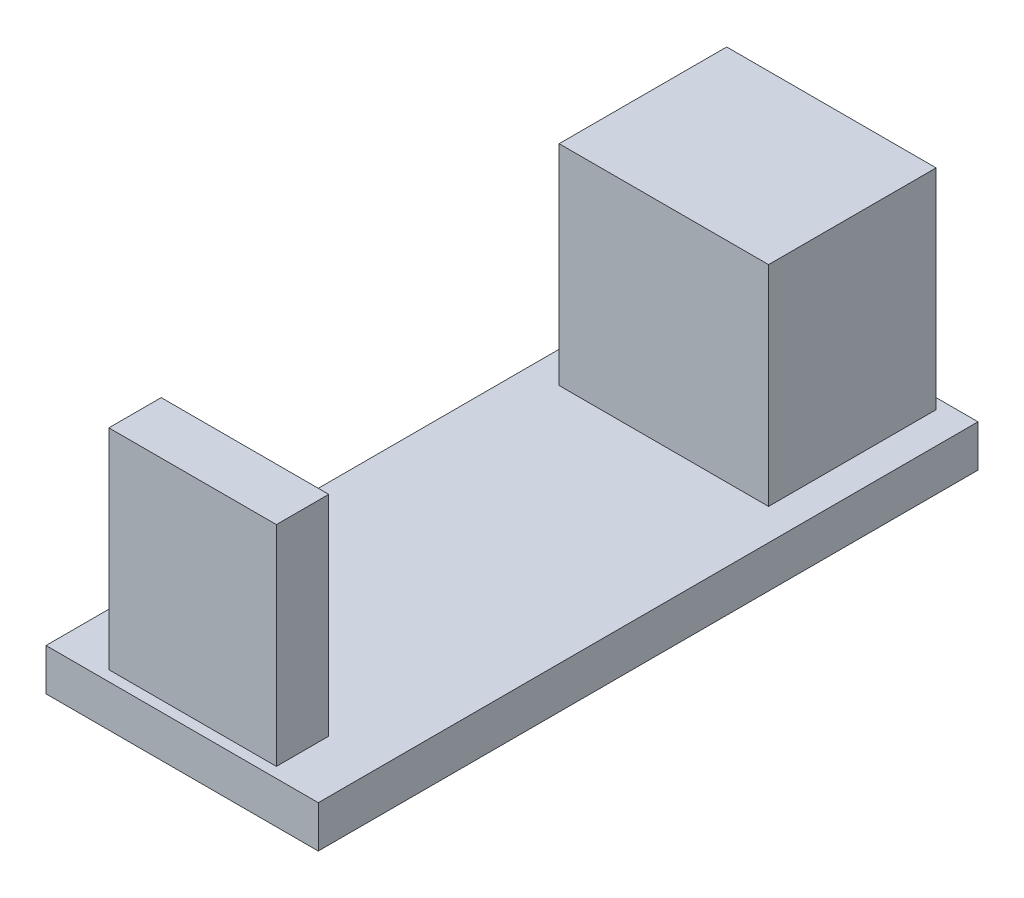
from build123d import *

# Parameters (mm, degrees)
ESBO_O1_W                = 13
ESBO_O1_H                = 31.5
RESSALTO_EXTRUS_O1_DEPTH = 2
ESBO_O2_W                = 10
ESBO_O2_H                = 8
ESBO_O2_W_2              = 8
ESBO_O2_H_2              = 2.5
RESSALTO_EXTRUS_O2_DEPTH = 10


with BuildPart() as part:
    # Esboço1 → Ressalto-extrusão1 (new body)
    with BuildSketch(Plane(origin=(0, 0, 0), x_dir=(1, 0, 0), z_dir=(0, 1, 0))):
        Rectangle(ESBO_O1_W, ESBO_O1_H)
    extrude(amount=RESSALTO_EXTRUS_O1_DEPTH)

    # Esboço2 → Ressalto-extrusão2 (add)
    with BuildSketch(Plane(origin=(0, 2, 0), x_dir=(1, 0, 0), z_dir=(0, 1, 0))):
        with Locations((0, 11.25)):
            Rectangle(ESBO_O2_W, ESBO_O2_H)
        with Locations((0, -14)):
            Rectangle(ESBO_O2_W_2, ESBO_O2_H_2)
    extrude(amount=RESSALTO_EXTRUS_O2_DEPTH)


solid = part.part
